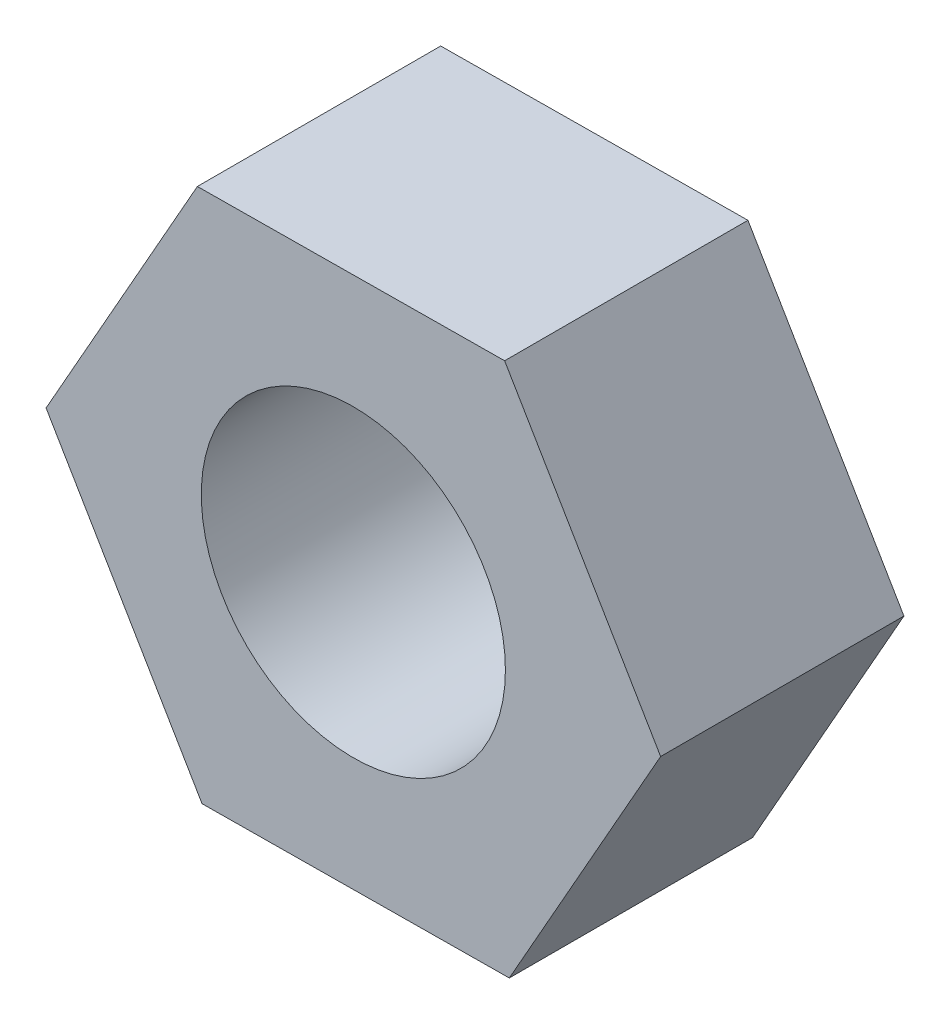
from build123d import *

# Parameters (mm, degrees)
SKETCH_1_R      = 2
EXTRUDE_1_DEPTH = 3.2


with BuildPart() as part:
    # 草图1 → 凸台-拉伸1 (new body)
    with BuildSketch(Plane.XY):
        Polygon((2.051456248, -3.482077052), (4.041295309, 0.035574699), (1.989839061, 3.517651751), (-2.051456248, 3.482077052), (-4.041295309, -0.035574699), (-1.989839061, -3.517651751), align=None)
        Circle(SKETCH_1_R, mode=Mode.SUBTRACT)
    extrude(amount=EXTRUDE_1_DEPTH)


solid = part.part
